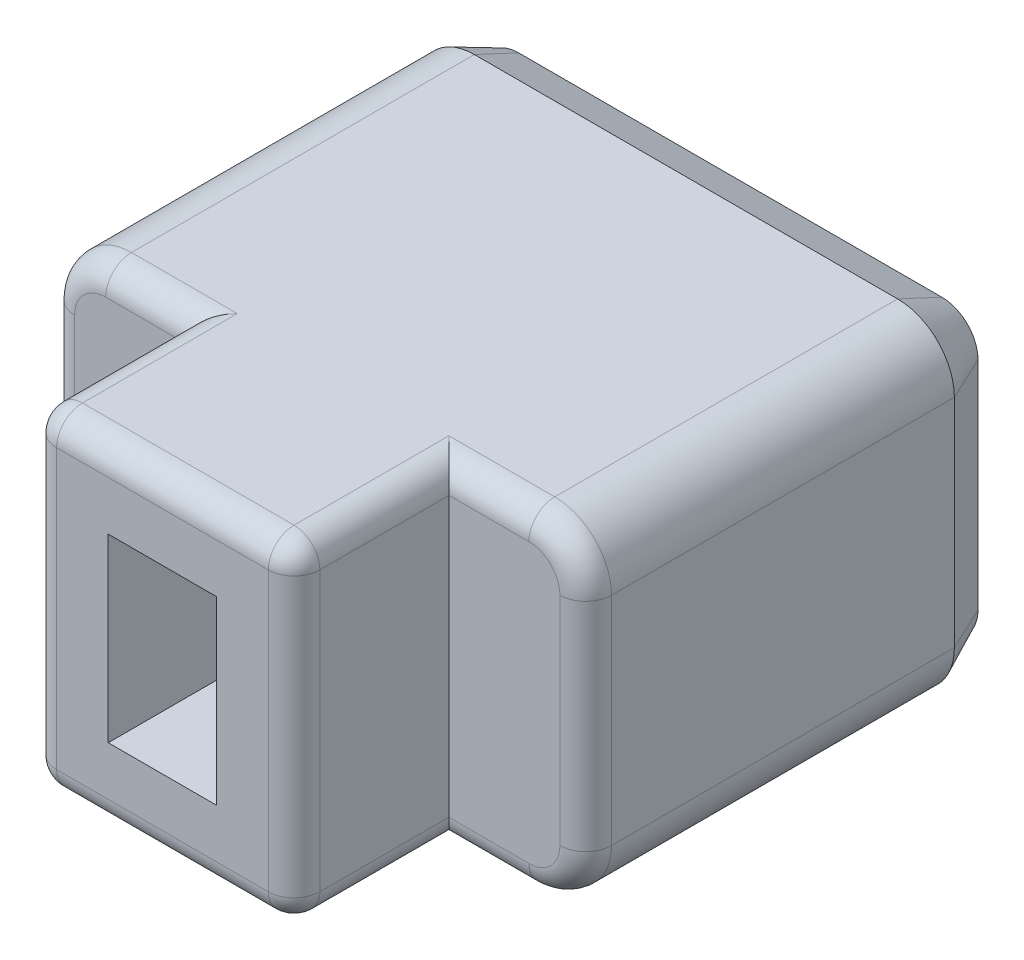
from build123d import *

# Parameters (mm, degrees)
BOSS_EXTRU_1_DEPTH      = 11
ESQUISSE3_W             = 2.1
ESQUISSE3_H             = 3.5
ENL_V_MAT_EXTRU_1_DEPTH = 3
ESQUISSE4_OUTSIDE_W     = 15.688
ESQUISSE4_OUTSIDE_H     = 11.688
ESQUISSE4_OUTSIDE_W_2   = 5.1
ESQUISSE4_OUTSIDE_H_2   = 6.4
ENL_V_MAT_EXTRU_2_DEPTH = 3
CONG_1_R                = 0.5
CHANFREIN1_SIZE         = 0.4
CHANFREIN1_SIZE2        = 0.857802768
ENL_V_MAT_EXTRU_3_DEPTH = 0.3
BOSS_EXTRU_2_DEPTH      = 0.3
BOSS_EXTRU_2_2_DEPTH    = 0.3
BOSS_EXTRU_2_3_DEPTH    = 0.3


with BuildPart() as part:
    # Esquisse2 → Boss.-Extru.1 (new body)
    with BuildSketch(Plane.XY):
        with BuildLine():
            Line((1.1, 0), (9.3, 0))
            ThreePointArc((9.3, 0), (10.077817459, 0.322182541), (10.4, 1.1))
            Line((10.4, 1.1), (10.4, 5.3))
            ThreePointArc((10.4, 5.3), (10.077817459, 6.077817459), (9.3, 6.4))
            Line((9.3, 6.4), (1.1, 6.4))
            ThreePointArc((1.1, 6.4), (0.322182541, 6.077817459), (0, 5.3))
            Line((0, 5.3), (0, 1.1))
            ThreePointArc((0, 1.1), (0.322182541, 0.322182541), (1.1, 0))
        make_face()
    extrude(amount=BOSS_EXTRU_1_DEPTH)

    # Esquisse3 → Enlèv. mat.-Extru.1 (cut)
    with BuildSketch(Plane.XY.offset(11)):
        with Locations((5.2, 3.2)):
            Rectangle(ESQUISSE3_W, ESQUISSE3_H)
    extrude(amount=-ENL_V_MAT_EXTRU_1_DEPTH, mode=Mode.SUBTRACT)

    # Esquisse4 outside → Enlèv. mat.-Extru.2 (cut)
    with BuildSketch(Plane.XY.offset(11)):
        with Locations((5.2, 3.2)):
            Rectangle(ESQUISSE4_OUTSIDE_W, ESQUISSE4_OUTSIDE_H)
        with Locations((5.2, 3.2)):
            Rectangle(ESQUISSE4_OUTSIDE_W_2, ESQUISSE4_OUTSIDE_H_2, mode=Mode.SUBTRACT)
    extrude(amount=-ENL_V_MAT_EXTRU_2_DEPTH, mode=Mode.SUBTRACT)

    # Congé1
    cong_1_edges = [part.edges().sort_by_distance(p)[0] for p in [
        (8.525, 0, 8),
        (10.077817459, 0.322182541, 8),
        (10.4, 3.2, 8),
        (10.077817459, 6.077817459, 8),
        (1.875, 6.4, 8),
        (0.322182541, 6.077817459, 8),
        (1.875, 0, 8),
        (0.322182541, 0.322182541, 8),
        (7.75, 6.4, 9.5),
        (2.65, 6.4, 9.5),
        (7.75, 0, 9.5),
        (2.65, 0, 9.5),
        (2.65, 3.2, 11),
        (5.2, 6.4, 11),
        (7.75, 3.2, 11),
        (5.2, 0, 11),
        (8.525, 6.4, 8),
        (0, 3.2, 8),
    ]]
    fillet(cong_1_edges, radius=CONG_1_R)

    # Chanfrein1
    chanfrein1_edges = [part.edges().sort_by_distance(p)[0] for p in [
        (5.2, 0, 0),
        (10.077817459, 0.322182541, 0),
        (0.322182541, 0.322182541, 0),
        (10.4, 3.2, 0),
        (0, 3.2, 0),
        (10.077817459, 6.077817459, 0),
        (0.322182541, 6.077817459, 0),
        (5.2, 6.4, 0),
    ]]
    chanfrein1_side = [part.faces().sort_by_distance(p)[0] for p in [
        (5.2, 3.2, 0),
    ]]
    chamfer(chanfrein1_edges, length=CHANFREIN1_SIZE, length2=CHANFREIN1_SIZE2, reference=chanfrein1_side[0])

    # Esquisse5 → Enlèv. mat.-Extru.3 (cut)
    # profile 1 of 3: a face of its own
    with BuildSketch(Plane(origin=(0, 0, 0), x_dir=(-1, 0, 0), z_dir=(0, 0, -1))):
        Polygon((-1.020512821, 1.3), (-1.409935897, 1.3), (-2.533333333, 4.322435897), (-3.656730769, 1.3), (-4.046153846, 1.3), (-2.558974359, 5.3), (-2.507692308, 5.3), align=None)
    # profile 2 of 3: a face of its own
    with BuildSketch(Plane(origin=(0, 0, 0), x_dir=(-1, 0, 0), z_dir=(0, 0, -1))):
        Polygon((-4.661538462, 1.3), (-6.405128205, 1.3), (-6.405128205, 1.71025641), (-5.020512821, 1.71025641), (-5.020512821, 2.941025641), (-6.405128205, 2.941025641), (-6.405128205, 3.351282051), (-5.020512821, 3.351282051), (-5.020512821, 5.3), (-4.661538462, 5.3), align=None)
    # profile 3 of 3: a face of its own
    with BuildSketch(Plane(origin=(0, 0, 0), x_dir=(-1, 0, 0), z_dir=(0, 0, -1))):
        with BuildLine():
            Line((-7.020512821, 1.3), (-7.722435897, 1.3))
            add(Edge.make_bspline(
                [(-7.722435897, 1.3), (-7.769444044, 1.3001758), (-7.859460733, 1.300512444), (-7.98851141, 1.30243476), (-8.105730858, 1.307883219), (-8.211345573, 1.312567873), (-8.305040018, 1.321160882), (-8.386952018, 1.329228391), (-8.457062524, 1.340225169), (-8.499455919, 1.350001033), (-8.518910256, 1.354487179)],
                knots=[0, 0, 0, 0, 1.410548186, 2.701082353, 3.872164956, 4.931545487, 5.872643019, 6.694846481, 7.4010648, 8, 8, 8, 8], degree=3))
            add(Edge.make_bspline(
                [(-8.518910256, 1.354487179), (-8.544449911, 1.361740702), (-8.595248098, 1.376167905), (-8.668176885, 1.406439045), (-8.737984809, 1.441506074), (-8.804254063, 1.482432658), (-8.865952127, 1.530293066), (-8.924705291, 1.583010705), (-8.979138515, 1.642142742), (-9.030806021, 1.705691029), (-9.07573812, 1.775470425), (-9.116420173, 1.84848438), (-9.150056558, 1.926168245), (-9.177875311, 2.007354342), (-9.199875162, 2.092501008), (-9.214858707, 2.181499618), (-9.223649327, 2.274448402), (-9.224970525, 2.337641421), (-9.225641026, 2.369711538)],
                knots=[0, 0, 0, 0, 0.953163587, 1.89583545, 2.831398256, 3.758060157, 4.68893587, 5.633315694, 6.590672633, 7.573797765, 8.571889309, 9.568272541, 10.573809546, 11.608637311, 12.649011887, 13.729676081, 14.847822807, 16, 16, 16, 16], degree=3))
            add(Edge.make_bspline(
                [(-9.225641026, 2.369711538), (-9.223893826, 2.422954138), (-9.220493564, 2.526570717), (-9.195623105, 2.677261673), (-9.152594929, 2.81754481), (-9.094826437, 2.948255807), (-9.019033028, 3.065244445), (-8.929392987, 3.169018947), (-8.823804298, 3.255709115), (-8.7252966, 3.316142217), (-8.638143734, 3.354829067), (-8.566724935, 3.381850513), (-8.488430711, 3.402787801), (-8.404794577, 3.421281099), (-8.315168735, 3.43568177), (-8.219689407, 3.445914246), (-8.118089984, 3.452378952), (-8.048300475, 3.453348696), (-8.0125, 3.453846154)],
                knots=[0, 0, 0, 0, 1.376217794, 2.678287309, 3.93428021, 5.161237768, 6.360266741, 7.524963188, 8.691990789, 9.878588042, 10.499780802, 11.155222415, 11.850483239, 12.59271203, 13.369193386, 14.195792071, 15.07448124, 16, 16, 16, 16], degree=3))
            Line((-8.0125, 3.453846154), (-9.276923077, 5.3))
            Line((-9.276923077, 5.3), (-8.821794872, 5.3))
            Line((-8.821794872, 5.3), (-7.557371795, 3.453846154))
            Line((-7.557371795, 3.453846154), (-7.379487179, 3.453846154))
            Line((-7.379487179, 3.453846154), (-7.379487179, 5.3))
            Line((-7.379487179, 5.3), (-7.020512821, 5.3))
            Line((-7.020512821, 5.3), (-7.020512821, 1.3))
        make_face()
        with BuildLine():
            Line((-7.379487179, 1.71025641), (-7.379487179, 3.043589744))
            Line((-7.379487179, 3.043589744), (-7.986057692, 3.049198718))
            add(Edge.make_bspline(
                [(-7.986057692, 3.049198718), (-8.014377096, 3.049210151), (-8.069445102, 3.049232382), (-8.149040024, 3.044690832), (-8.223110765, 3.039498774), (-8.291299395, 3.031522413), (-8.353897551, 3.021209602), (-8.410706433, 3.008671123), (-8.461841651, 2.993317462), (-8.521732472, 2.970298044), (-8.589657205, 2.934767812), (-8.660639371, 2.879433289), (-8.722878991, 2.813395636), (-8.773853172, 2.736538502), (-8.816342693, 2.652636038), (-8.844073081, 2.561970672), (-8.864196625, 2.46728064), (-8.865832215, 2.402142615), (-8.866666667, 2.368910256)],
                knots=[0, 0, 0, 0, 1.065115818, 2.071152542, 2.998223466, 3.858177936, 4.652718105, 5.384003046, 6.045176779, 6.659081028, 7.796261142, 8.913693857, 10.029725289, 11.194622041, 12.371932755, 13.553993211, 14.752087226, 16, 16, 16, 16], degree=3))
            add(Edge.make_bspline(
                [(-8.866666667, 2.368910256), (-8.865764306, 2.336760519), (-8.863981554, 2.273243778), (-8.844517895, 2.180651775), (-8.814844306, 2.092194398), (-8.773674906, 2.009394504), (-8.721694276, 1.935229452), (-8.66202568, 1.870951797), (-8.594523077, 1.818145247), (-8.531641052, 1.782945664), (-8.474830382, 1.762101483), (-8.426269991, 1.747469387), (-8.370891417, 1.736739671), (-8.309408708, 1.727226354), (-8.241278933, 1.71912867), (-8.166688714, 1.713725393), (-8.085713296, 1.710490094), (-8.029597271, 1.710336239), (-8.000480769, 1.71025641)],
                knots=[0, 0, 0, 0, 1.233968552, 2.43789431, 3.619555944, 4.813196433, 5.977971186, 7.089174201, 8.171406254, 9.260239712, 9.841766941, 10.494663619, 11.20736683, 12.007361027, 12.8859566, 13.843359851, 14.8810003, 16, 16, 16, 16], degree=3))
            Line((-8.000480769, 1.71025641), (-7.379487179, 1.71025641))
        make_face(mode=Mode.SUBTRACT)
    extrude(amount=-ENL_V_MAT_EXTRU_3_DEPTH, mode=Mode.SUBTRACT)


with BuildPart() as body_2:
    # Esquisse5<2> → Boss.-Extru.2 (new body)
    with BuildSketch(Plane(origin=(0, 0, 0), x_dir=(-1, 0, 0), z_dir=(0, 0, -1))):
        Polygon((-1.020512821, 1.3), (-1.409935897, 1.3), (-2.533333333, 4.322435897), (-3.656730769, 1.3), (-4.046153846, 1.3), (-2.558974359, 5.3), (-2.507692308, 5.3), align=None)
    extrude(amount=BOSS_EXTRU_2_DEPTH)


with BuildPart() as body_3:
    # Esquisse5<2> → Boss.-Extru.2 2 (new body)
    with BuildSketch(Plane(origin=(0, 0, 0), x_dir=(-1, 0, 0), z_dir=(0, 0, -1))):
        Polygon((-4.661538462, 1.3), (-6.405128205, 1.3), (-6.405128205, 1.71025641), (-5.020512821, 1.71025641), (-5.020512821, 2.941025641), (-6.405128205, 2.941025641), (-6.405128205, 3.351282051), (-5.020512821, 3.351282051), (-5.020512821, 5.3), (-4.661538462, 5.3), align=None)
    extrude(amount=BOSS_EXTRU_2_2_DEPTH)


with BuildPart() as body_4:
    # Esquisse5<2> → Boss.-Extru.2 3 (new body)
    with BuildSketch(Plane(origin=(0, 0, 0), x_dir=(-1, 0, 0), z_dir=(0, 0, -1))):
        with BuildLine():
            Line((-7.020512821, 1.3), (-7.722435897, 1.3))
            add(Edge.make_bspline(
                [(-7.722435897, 1.3), (-7.769444044, 1.3001758), (-7.859460733, 1.300512444), (-7.98851141, 1.30243476), (-8.105730858, 1.307883219), (-8.211345573, 1.312567873), (-8.305040018, 1.321160882), (-8.386952018, 1.329228391), (-8.457062524, 1.340225169), (-8.499455919, 1.350001033), (-8.518910256, 1.354487179)],
                knots=[0, 0, 0, 0, 1.410548186, 2.701082353, 3.872164956, 4.931545487, 5.872643019, 6.694846481, 7.4010648, 8, 8, 8, 8], degree=3))
            add(Edge.make_bspline(
                [(-8.518910256, 1.354487179), (-8.544449911, 1.361740702), (-8.595248098, 1.376167905), (-8.668176885, 1.406439045), (-8.737984809, 1.441506074), (-8.804254063, 1.482432658), (-8.865952127, 1.530293066), (-8.924705291, 1.583010705), (-8.979138515, 1.642142742), (-9.030806021, 1.705691029), (-9.07573812, 1.775470425), (-9.116420173, 1.84848438), (-9.150056558, 1.926168245), (-9.177875311, 2.007354342), (-9.199875162, 2.092501008), (-9.214858707, 2.181499618), (-9.223649327, 2.274448402), (-9.224970525, 2.337641421), (-9.225641026, 2.369711538)],
                knots=[0, 0, 0, 0, 0.953163587, 1.89583545, 2.831398256, 3.758060157, 4.68893587, 5.633315694, 6.590672633, 7.573797765, 8.571889309, 9.568272541, 10.573809546, 11.608637311, 12.649011887, 13.729676081, 14.847822807, 16, 16, 16, 16], degree=3))
            add(Edge.make_bspline(
                [(-9.225641026, 2.369711538), (-9.223893826, 2.422954138), (-9.220493564, 2.526570717), (-9.195623105, 2.677261673), (-9.152594929, 2.81754481), (-9.094826437, 2.948255807), (-9.019033028, 3.065244445), (-8.929392987, 3.169018947), (-8.823804298, 3.255709115), (-8.7252966, 3.316142217), (-8.638143734, 3.354829067), (-8.566724935, 3.381850513), (-8.488430711, 3.402787801), (-8.404794577, 3.421281099), (-8.315168735, 3.43568177), (-8.219689407, 3.445914246), (-8.118089984, 3.452378952), (-8.048300475, 3.453348696), (-8.0125, 3.453846154)],
                knots=[0, 0, 0, 0, 1.376217794, 2.678287309, 3.93428021, 5.161237768, 6.360266741, 7.524963188, 8.691990789, 9.878588042, 10.499780802, 11.155222415, 11.850483239, 12.59271203, 13.369193386, 14.195792071, 15.07448124, 16, 16, 16, 16], degree=3))
            Line((-8.0125, 3.453846154), (-9.276923077, 5.3))
            Line((-9.276923077, 5.3), (-8.821794872, 5.3))
            Line((-8.821794872, 5.3), (-7.557371795, 3.453846154))
            Line((-7.557371795, 3.453846154), (-7.379487179, 3.453846154))
            Line((-7.379487179, 3.453846154), (-7.379487179, 5.3))
            Line((-7.379487179, 5.3), (-7.020512821, 5.3))
            Line((-7.020512821, 5.3), (-7.020512821, 1.3))
        make_face()
        with BuildLine():
            Line((-7.379487179, 1.71025641), (-7.379487179, 3.043589744))
            Line((-7.379487179, 3.043589744), (-7.986057692, 3.049198718))
            add(Edge.make_bspline(
                [(-7.986057692, 3.049198718), (-8.014377096, 3.049210151), (-8.069445102, 3.049232382), (-8.149040024, 3.044690832), (-8.223110765, 3.039498774), (-8.291299395, 3.031522413), (-8.353897551, 3.021209602), (-8.410706433, 3.008671123), (-8.461841651, 2.993317462), (-8.521732472, 2.970298044), (-8.589657205, 2.934767812), (-8.660639371, 2.879433289), (-8.722878991, 2.813395636), (-8.773853172, 2.736538502), (-8.816342693, 2.652636038), (-8.844073081, 2.561970672), (-8.864196625, 2.46728064), (-8.865832215, 2.402142615), (-8.866666667, 2.368910256)],
                knots=[0, 0, 0, 0, 1.065115818, 2.071152542, 2.998223466, 3.858177936, 4.652718105, 5.384003046, 6.045176779, 6.659081028, 7.796261142, 8.913693857, 10.029725289, 11.194622041, 12.371932755, 13.553993211, 14.752087226, 16, 16, 16, 16], degree=3))
            add(Edge.make_bspline(
                [(-8.866666667, 2.368910256), (-8.865764306, 2.336760519), (-8.863981554, 2.273243778), (-8.844517895, 2.180651775), (-8.814844306, 2.092194398), (-8.773674906, 2.009394504), (-8.721694276, 1.935229452), (-8.66202568, 1.870951797), (-8.594523077, 1.818145247), (-8.531641052, 1.782945664), (-8.474830382, 1.762101483), (-8.426269991, 1.747469387), (-8.370891417, 1.736739671), (-8.309408708, 1.727226354), (-8.241278933, 1.71912867), (-8.166688714, 1.713725393), (-8.085713296, 1.710490094), (-8.029597271, 1.710336239), (-8.000480769, 1.71025641)],
                knots=[0, 0, 0, 0, 1.233968552, 2.43789431, 3.619555944, 4.813196433, 5.977971186, 7.089174201, 8.171406254, 9.260239712, 9.841766941, 10.494663619, 11.20736683, 12.007361027, 12.8859566, 13.843359851, 14.8810003, 16, 16, 16, 16], degree=3))
            Line((-8.000480769, 1.71025641), (-7.379487179, 1.71025641))
        make_face(mode=Mode.SUBTRACT)
    extrude(amount=BOSS_EXTRU_2_3_DEPTH)


solid = Compound([part.part, body_2.part, body_3.part, body_4.part])
